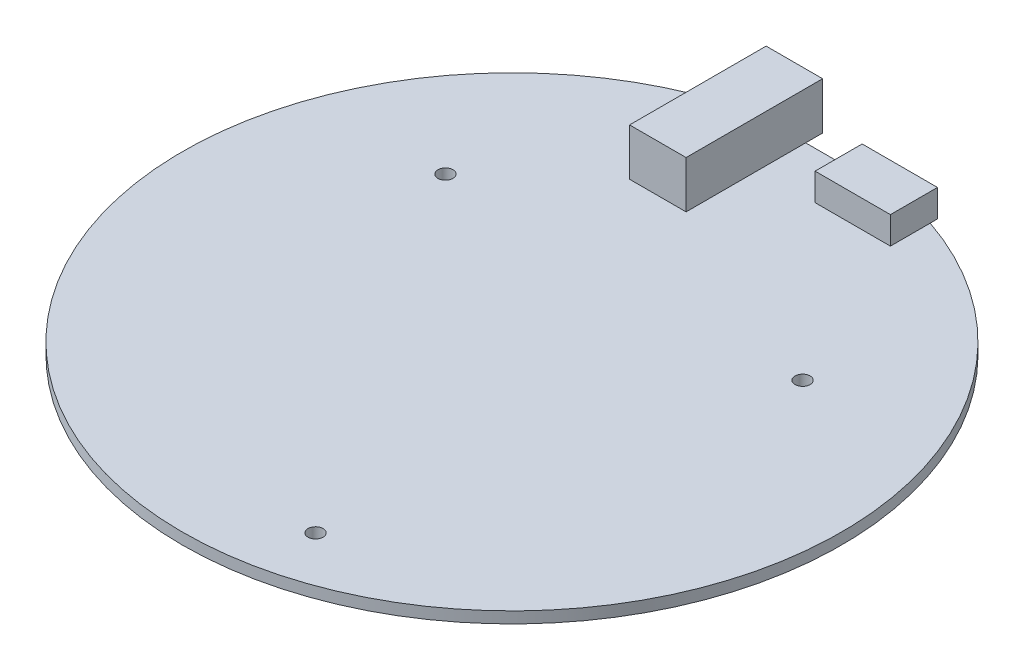
from build123d import *

# Parameters (mm, degrees)
BOSS_EXTRUDE1_DEPTH = 5
SKETCH1_4_R         = 0.8
BOSS_EXTRUDE3_DEPTH = 1.2
SKETCH4_W           = 8
SKETCH4_H           = 5
BOSS_EXTRUDE5_DEPTH = 2.9


with BuildPart() as part:
    # Sketch1 → Boss-Extrude1 (new body)
    with BuildSketch(Plane(origin=(0, 0, 0), x_dir=(1, 0, 0), z_dir=(0, 1, 0))):
        Polygon((-8.705745229, 33.9), (-8.705745229, 35.7), (-2.705745229, 35.7), (-2.705745229, 33.9), (-2.705745229, 21.2), (-8.705745229, 21.2), align=None)
    extrude(amount=BOSS_EXTRUDE1_DEPTH)

    # Sketch1<4> → Boss-Extrude3 (add)
    with BuildSketch(Plane(origin=(0, 0, 0), x_dir=(1, 0, 0), z_dir=(0, 1, 0))):
        with BuildLine():
            ThreePointArc((-8.705745229, 33.9), (0, -35), (8.705745229, 33.9))
            Line((8.705745229, 33.9), (-8.705745229, 33.9))
        make_face()
        with Locations((7.14, -28)):
            Circle(SKETCH1_4_R, mode=Mode.SUBTRACT)
        with Locations((-18.963757819, 11.9)):
            Circle(SKETCH1_4_R, mode=Mode.SUBTRACT)
        with Locations((18.963757819, 11.9)):
            Circle(SKETCH1_4_R, mode=Mode.SUBTRACT)
    extrude(amount=-BOSS_EXTRUDE3_DEPTH)

    # Sketch4 → Boss-Extrude5 (add)
    with BuildSketch(Plane(origin=(0, 0, 0), x_dir=(1, 0, 0), z_dir=(0, 1, 0))):
        with Locations((7.294254771, 31.4)):
            Rectangle(SKETCH4_W, SKETCH4_H)
    extrude(amount=BOSS_EXTRUDE5_DEPTH)


solid = part.part
